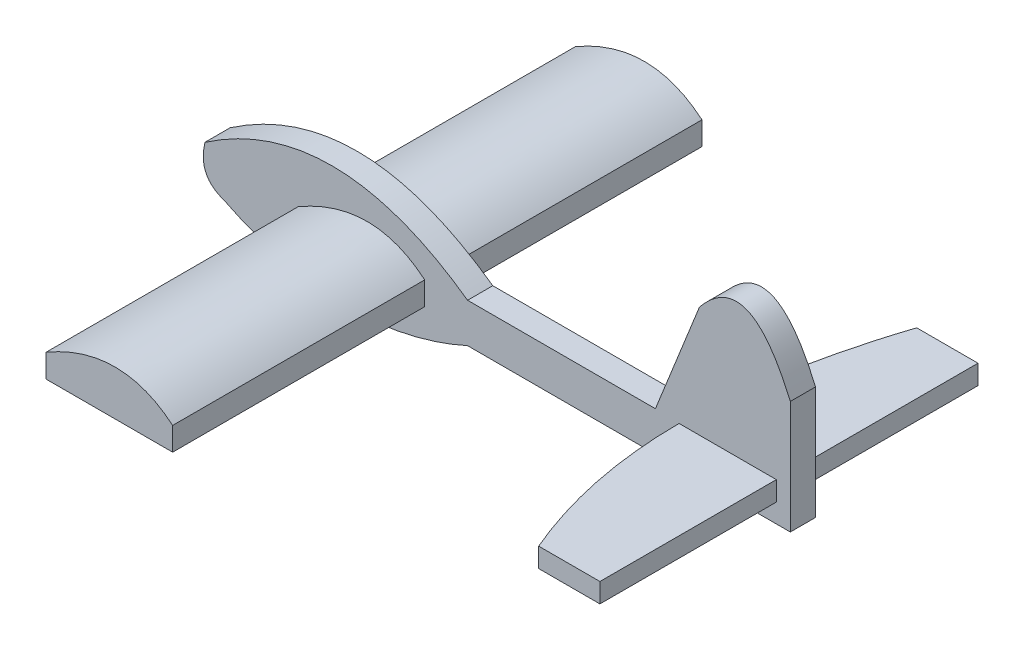
from build123d import *

# Parameters (mm, degrees)
BOSS_EXTRUDE1_DEPTH      = 10
BOSS_EXTRUDE4_DEPTH      = 110
BOSS_EXTRUDE4_DEPTH_BACK = 100
SKETCH2_W                = 50.249872444
SKETCH2_H                = 9.213429789
BOSS_EXTRUDE6_DEPTH      = 210
BOSS_EXTRUDE9_DEPTH      = 70
BOSS_EXTRUDE9_DEPTH_BACK = 80
SKETCH6_W                = 38.58561731
SKETCH6_H                = 7.717123462
CUT_EXTRUDE1_DEPTH       = 70
CUT_EXTRUDE2_DEPTH       = 222.915349689
CUT_EXTRUDE2_DEPTH_BACK  = 222.915349689


with BuildPart() as part:
    # Sketch1 → Boss-Extrude1 (new body)
    with BuildSketch(Plane.XY):
        with BuildLine():
            Line((57.181832049, 10.710247908), (131.703459222, 10.710247908))
            Line((131.703459222, 10.710247908), (149.186074684, 54.392465481))
            add(Edge.make_bspline(
                [(149.186074684, 54.392465481), (168.827192519, 78.384539795), (185.224129689, 39.969217472)],
                knots=[0, 0, 0, 1, 1, 1], degree=2))
            Line((185.224129689, 39.969217472), (185.224129689, -4.90129989))
            Line((185.224129689, -4.90129989), (57.181832049, -4.90129989))
            add(Edge.make_bspline(
                [(-39.754987996, -3.086003634), (8.172307478, -26.913609431), (57.181832049, -4.90129989)],
                knots=[0, 0, 0, 1, 1, 1], degree=2))
            add(Edge.make_bspline(
                [(-47.016173018, 12.888603414), (-49.928971692, 0.460306463), (-39.754987996, -3.086003634)],
                knots=[0, 0, 0, 1, 1, 1], degree=2))
            add(Edge.make_bspline(
                [(-47.016173018, 12.888603414), (4.654032658, 48.21998755), (57.181832049, 10.710247908)],
                knots=[0, 0, 0, 1, 1, 1], degree=2))
        make_face()
    extrude(amount=BOSS_EXTRUDE1_DEPTH)

    # Sketch2 → Boss-Extrude4 (add, two sides: drawn at the far end of the back side and taken through both)
    with BuildSketch(Plane.XY.offset(-BOSS_EXTRUDE4_DEPTH_BACK)):
        with Locations((15.052306438, 4.606714895)):
            Rectangle(SKETCH2_W, SKETCH2_H)
    extrude(amount=BOSS_EXTRUDE4_DEPTH + BOSS_EXTRUDE4_DEPTH_BACK)

    # Sketch3 → Boss-Extrude6 (add)
    with BuildSketch(Plane(origin=(0, 0, -100), x_dir=(-1, 0, 0), z_dir=(0, 0, -1))):
        with BuildLine():
            Line((-40.17724266, 9.213429789), (-40.17724266, 0))
            Line((-40.17724266, 0), (10.072629784, 0))
            Line((10.072629784, 0), (10.072629784, 9.213429789))
            add(Edge.make_bspline(
                [(-40.17724266, 9.213429789), (-19.522810461, 26.526032518), (10.072629784, 9.213429789)],
                knots=[0, 0, 0, 1, 1, 1], degree=2))
        make_face()
    extrude(amount=-BOSS_EXTRUDE6_DEPTH)

    # Sketch6 → Boss-Extrude9 (add, two sides: drawn at the far end of the back side and taken through both)
    with BuildSketch(Plane.XY.offset(10).offset(-BOSS_EXTRUDE9_DEPTH_BACK)):
        with Locations((160.393476949, 6.480433212)):
            Rectangle(SKETCH6_W, SKETCH6_H)
    extrude(amount=BOSS_EXTRUDE9_DEPTH + BOSS_EXTRUDE9_DEPTH_BACK)

    # Sketch7 → Cut-Extrude1 (cut)
    with BuildSketch(Plane(origin=(0, 10.338994943, 0), x_dir=(1, 0, 0), z_dir=(0, 1, 0))):
        with BuildLine():
            Line((141.100668294, -10), (141.100668294, -80))
            Line((141.100668294, -80), (155.374228958, -80))
            add(Edge.make_bspline(
                [(141.100668294, -10), (141.156131379, -46.554762938), (155.374228958, -80)],
                knots=[0, 0, 0, 1, 1, 1], degree=2))
        make_face()
    extrude(amount=-CUT_EXTRUDE1_DEPTH, mode=Mode.SUBTRACT)

    # Sketch10 → Cut-Extrude2 (cut, two sides: drawn at the far end of the back side and taken through both)
    with BuildSketch(Plane(origin=(0, 10.338994943, 0), x_dir=(1, 0, 0), z_dir=(0, 1, 0)).offset(-CUT_EXTRUDE2_DEPTH_BACK)):
        with BuildLine():
            Line((141.100668294, 70), (141.100668294, 0))
            add(Edge.make_bspline(
                [(141.100668294, 0), (144.11108971, 35.90170366), (155.374228958, 70)],
                knots=[0, 0, 0, 1, 1, 1], degree=2))
            Line((155.374228958, 70), (141.100668294, 70))
        make_face()
    extrude(amount=CUT_EXTRUDE2_DEPTH + CUT_EXTRUDE2_DEPTH_BACK, mode=Mode.SUBTRACT)


solid = part.part
